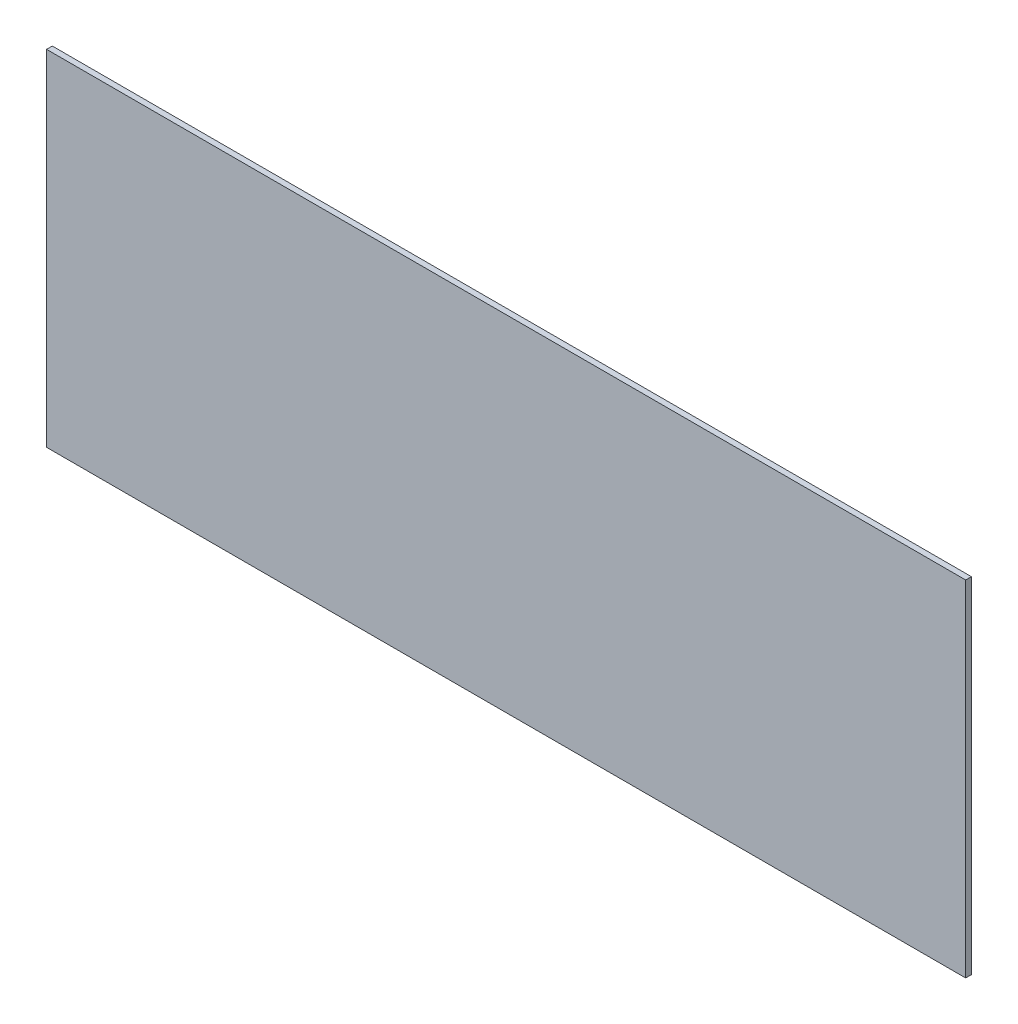
from build123d import *

# Parameters (mm, degrees)
SKETCH1_W           = 406.4
SKETCH1_H           = 152.4
BOSS_EXTRUDE1_DEPTH = 2.54


with BuildPart() as part:
    # Sketch1 → Boss-Extrude1 (new body)
    with BuildSketch(Plane.XY):
        with Locations((203.2, 76.2)):
            Rectangle(SKETCH1_W, SKETCH1_H)
    extrude(amount=BOSS_EXTRUDE1_DEPTH)


solid = part.part
